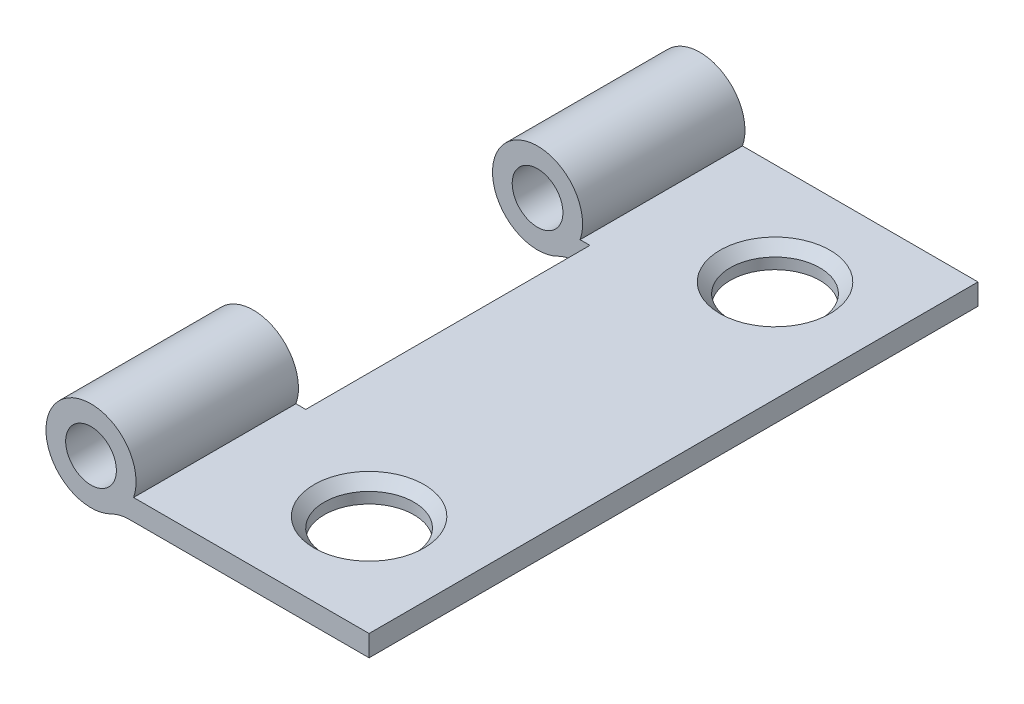
from build123d import *

# Parameters (mm, degrees)
SKETCH2_R                       = 2.8194
SKETCH2_R_2                     = 1.5875
BOSS_EXTRUDE1_DEPTH             = 19.05
BOSS_EXTRUDE2_REACH             = 21.463
BOSS_EXTRUDE2_DIRECTION_2_REACH = 21.463
FILLET1_R                       = 2.54
SKETCH4_W                       = 6.5532
SKETCH4_H                       = 6.5532
CUT_EXTRUDE1_DEPTH              = 8.89
F_10_CLEARANCE_HOLE1_AT_2_COUNT = 2
F_10_CLEARANCE_HOLE1_AT_2_PITCH = 25.4


with BuildPart() as part:
    # Sketch2 → Boss-Extrude1 (new, symmetric)
    with BuildSketch(Plane.XY):
        with Locations(Location((0, 0, 0), (0, 0, 180))):
            Circle(SKETCH2_R)
        with Locations(Location((0, 0, 0), (0, 0, 180))):
            Circle(SKETCH2_R_2, mode=Mode.SUBTRACT)
    extrude(amount=BOSS_EXTRUDE1_DEPTH, both=True)

    # Boss-Extrude2: up to this face of the body (flat: up to its plane)
    boss_extrude2_end = Plane(part.part.faces().sort_by_distance((2.739655326, 0, 19.05))[0])
    # Sketch3 → Boss-Extrude2 (add, up to the picked face)
    with BuildSketch(Plane.XY, mode=Mode.PRIVATE) as boss_extrude2_sk1:
        with BuildLine():
            Line((2.662611866, -0.9271), (17.399, -0.9271))
            Line((17.399, -0.9271), (17.399, -2.2479))
            Line((17.399, -2.2479), (1.701752611, -2.2479))
            ThreePointArc((1.701752611, -2.2479), (2.279922692, -1.658604497), (2.662611866, -0.9271))
        make_face()
    boss_extrude2_tool1 = split(extrude(boss_extrude2_sk1.sketch, amount=BOSS_EXTRUDE2_REACH, mode=Mode.PRIVATE), bisect_by=boss_extrude2_end, keep=Keep.BOTH, mode=Mode.PRIVATE)
    add(boss_extrude2_tool1.solids().sort_by(Axis((9.838158, -1.594307, 0), (0, 0, 1)))[0])

    # Boss-Extrude2 direction 2: up to this face of the body (flat: up to its plane)
    boss_extrude2_direction_2_end = Plane(part.part.faces().sort_by_distance((2.739655326, 0, -19.05))[0])
    # Sketch3 → Boss-Extrude2 direction 2 (add, up to the picked face)
    with BuildSketch(Plane.XY, mode=Mode.PRIVATE) as boss_extrude2_direction_2_sk1:
        with BuildLine():
            Line((2.662611866, -0.9271), (17.399, -0.9271))
            Line((17.399, -0.9271), (17.399, -2.2479))
            Line((17.399, -2.2479), (1.701752611, -2.2479))
            ThreePointArc((1.701752611, -2.2479), (2.279922692, -1.658604497), (2.662611866, -0.9271))
        make_face()
    boss_extrude2_direction_2_tool1 = split(extrude(boss_extrude2_direction_2_sk1.sketch, amount=-BOSS_EXTRUDE2_DIRECTION_2_REACH, mode=Mode.PRIVATE), bisect_by=boss_extrude2_direction_2_end, keep=Keep.BOTH, mode=Mode.PRIVATE)
    add(boss_extrude2_direction_2_tool1.solids().sort_by(Axis((9.838158, -1.594307, 0), (0, 0, -1)))[0])

    # Fillet1
    fillet1_edges = [part.edges().sort_by_distance(p)[0] for p in [
        (1.701752611, -2.2479, 0),
    ]]
    fillet(fillet1_edges, radius=FILLET1_R)

    # Sketch4 → Cut-Extrude1 (cut, symmetric)
    with BuildSketch(Plane.XY):
        Rectangle(SKETCH4_W, SKETCH4_H)
    extrude(amount=CUT_EXTRUDE1_DEPTH, both=True, mode=Mode.SUBTRACT)

    # Sketch6 → #10 Clearance Hole1 (revolve, cut)
    with BuildSketch(Plane(origin=(11.049, -0.9271, -12.7), x_dir=(0, 0, 1), z_dir=(1, 0, 0))):
        Polygon((0, 0), (0, 1.8923), (2.8067, 1.8923), (2.8067, 0.635), (3.4417, 0), align=None)
    f_10_clearance_hole1 = revolve(axis=Axis((11.049, 5.4229, -12.7), (0, -1, 0)), mode=Mode.SUBTRACT)

    # #10 Clearance Hole1 at 2: #10 Clearance Hole1 ×2
    with Locations(*[(0, 0, i * F_10_CLEARANCE_HOLE1_AT_2_PITCH) for i in range(1, F_10_CLEARANCE_HOLE1_AT_2_COUNT)]):
        add(f_10_clearance_hole1, mode=Mode.SUBTRACT)


solid = part.part
